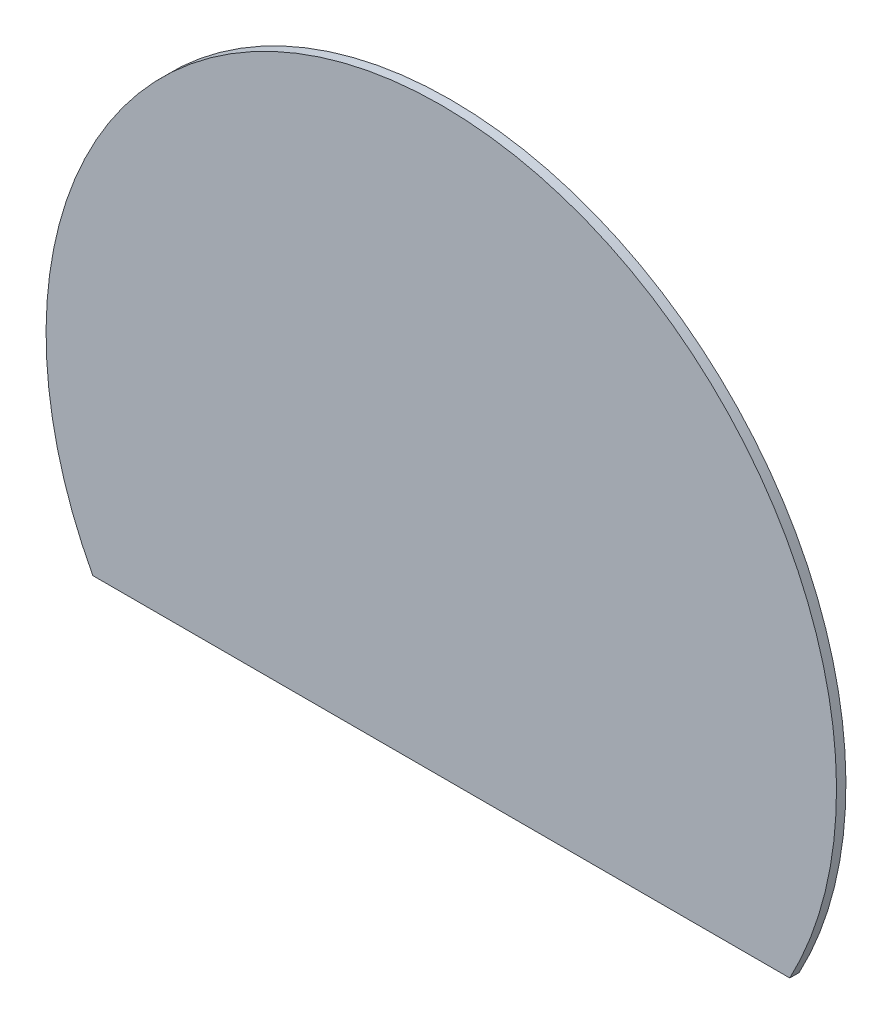
from build123d import *

# Parameters (mm, degrees)
EXTRUDE_1_DEPTH = 5


with BuildPart() as part:
    # 草图1 → 凸台-拉伸1 (new body)
    with BuildSketch(Plane.XY):
        with BuildLine():
            Line((-185.158751653, -99.076923077), (-13.225625118, -99.076923077))
            Line((-13.225625118, -99.076923077), (185.158751653, -99.076923077))
            ThreePointArc((185.158751653, -99.076923077), (0, 210), (-185.158751653, -99.076923077))
        make_face()
    extrude(amount=EXTRUDE_1_DEPTH)


solid = part.part
